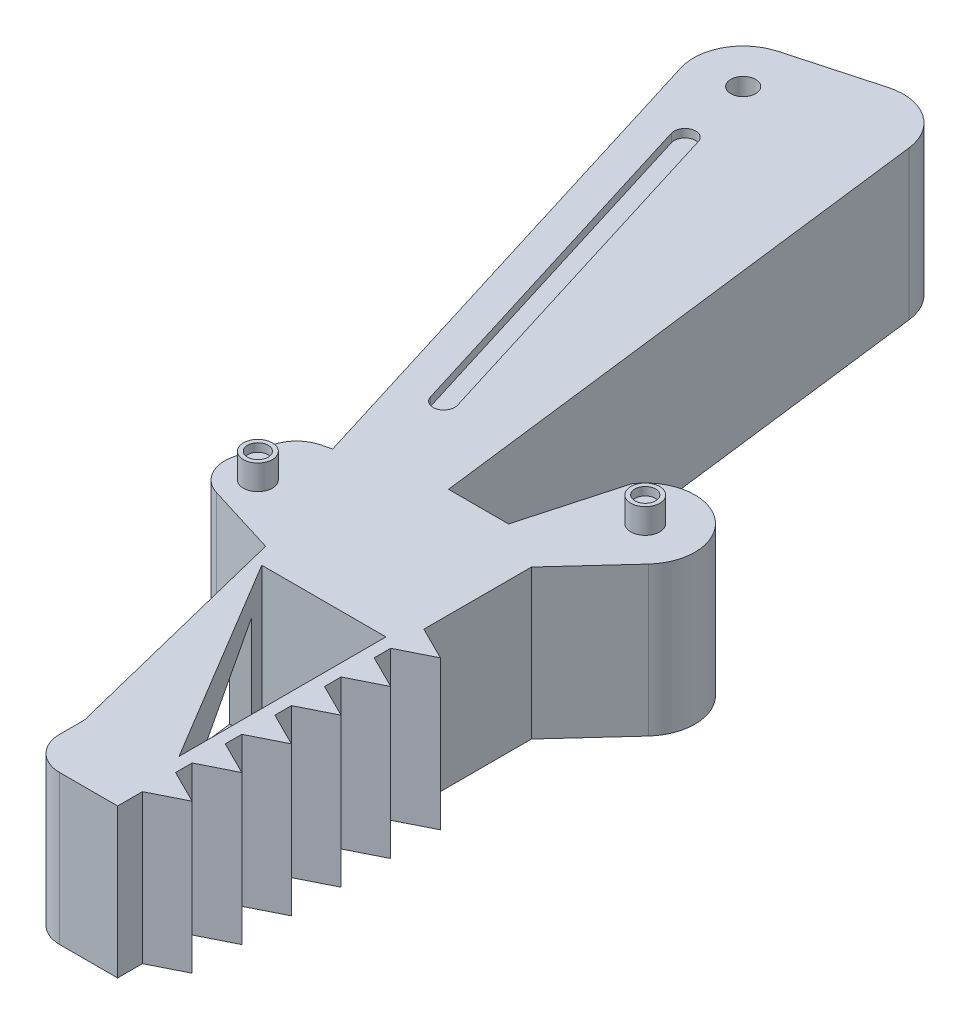
from build123d import *

# Parameters (mm, degrees)
BOSS_EXTRU_1_DEPTH         = 9
CONG_1_R                   = 6
CONG_2_R                   = 4
BOSS_EXTRU_2_DEPTH         = 18
R_P_TITION_LIN_AIRE1_COUNT = 6
R_P_TITION_LIN_AIRE1_PITCH = 6
ENL_V_MAT_EXTRU_1_DEPTH    = 131.397228353
ENL_V_MAT_EXTRU_2_DEPTH    = 10
ESQUISSE5_R                = 1.5
ENL_V_MAT_EXTRU_3_DEPTH    = 131.397228353
ESQUISSE7_R                = 1.75
BOSS_EXTRU_3_DEPTH         = 3
ESQUISSE8_R                = 1.25
ENL_V_MAT_EXTRU_4_DEPTH    = 1
ESQUISSE9_R                = 1.25
ENL_V_MAT_EXTRU_5_DEPTH    = 1
ENL_V_MAT_EXTRU_6_DEPTH    = 1


with BuildPart() as part:
    # Esquisse1 → Boss.-Extru.1 (new, symmetric)
    with BuildSketch(Plane(origin=(0, 0, 0), x_dir=(1, 0, 0), z_dir=(0, 1, 0))):
        with BuildLine():
            ThreePointArc((3.322818072, -58.807369293), (12.01141452, -57.437534528), (12.729634722, -66.204079757))
            Line((12.729634722, -66.204079757), (5.979619104, -73.58224275))
            Line((5.979619104, -73.58224275), (5.979619104, -123.58224275))
            Line((5.979619104, -123.58224275), (-5.020380896, -123.58224275))
            Line((-5.020380896, -123.58224275), (-5.020380896, -116.58224275))
            Line((-5.020380896, -116.58224275), (-12.254374663, -87.467481302))
            Line((-12.254374663, -87.467481302), (-24.674189245, -83.627142028))
            Line((-24.674189245, -83.627142028), (-21.720082111, -74.073438503))
            Line((-21.720082111, -74.073438503), (-7.162701387, -70.45644162))
            Line((-7.162701387, -70.45644162), (0.090794599, -70.45644162))
            Line((0.090794599, -70.45644162), (3.322818072, -58.807369293))
        make_face()
        Polygon((-7.162701387, -70.45644162), (-15.931386255, 0), (-39.070246498, -6.371275122), (-18.378388293, -73.243145172), align=None)
    extrude(amount=BOSS_EXTRU_1_DEPTH, both=True)

    # Congé1
    cong_1_edges = [part.edges().sort_by_distance(p)[0] for p in [
        (-39.070246498, 0, 6.371275122),
        (-15.931386255, 0, 0),
    ]]
    fillet(cong_1_edges, radius=CONG_1_R)

    # Congé2
    cong_2_edges = [part.edges().sort_by_distance(p)[0] for p in [
        (-5.020380896, 0, 123.58224275),
        (-24.674189245, 0, 83.627142028),
        (-21.720082111, 0, 74.073438503),
    ]]
    fillet(cong_2_edges, radius=CONG_2_R)

    # Esquisse2 → Boss.-Extru.2 (add, through all)
    with BuildSketch(Plane(origin=(0, 9, 0), x_dir=(1, 0, 0), z_dir=(0, 1, 0))):
        Polygon((5.979619104, -116.58224275), (5.979619104, -118.58224275), (9.979619104, -118.58224275), align=None)
        Polygon((5.979619104, -118.58224275), (5.979619104, -120.58224275), (9.979619104, -118.58224275), align=None)
    boss_extru_2 = extrude(amount=-BOSS_EXTRU_2_DEPTH)

    # Répétition linéaire1: Boss.-Extru.2 ×6
    with Locations(*[(0, 0, -i * R_P_TITION_LIN_AIRE1_PITCH) for i in range(1, R_P_TITION_LIN_AIRE1_COUNT)]):
        add(boss_extru_2)

    # Esquisse3 → Enlèv. mat.-Extru.1 (cut, through all)
    with BuildSketch(Plane(origin=(0, 9, 0), x_dir=(1, 0, 0), z_dir=(0, 1, 0))):
        Polygon((4.500460605, -114.682587681), (4.500460605, -89.682587681), (-10.499539395, -89.682587681), align=None)
    extrude(amount=-ENL_V_MAT_EXTRU_1_DEPTH, mode=Mode.SUBTRACT)

    # Esquisse4 → Enlèv. mat.-Extru.2 (cut)
    with BuildSketch(Plane(origin=(-32.010787668, 0, 7.953554381), x_dir=(0.24113312555809657, 0, 0.9704920482716916), z_dir=(-0.9704920482716917, 0, 0.2411331255580966))):
        Polygon((87.931559422, 6), (87.931559422, -6), (105.931559422, -3.5), (105.931559422, 3.5), align=None)
    extrude(amount=-ENL_V_MAT_EXTRU_2_DEPTH, mode=Mode.SUBTRACT)

    # Esquisse5 → Enlèv. mat.-Extru.3 (cut, through all)
    with BuildSketch(Plane(origin=(0, 9, 0), x_dir=(1, 0, 0), z_dir=(0, 1, 0))):
        with Locations(Location((-31.508218287, -10.512370957, 0), (0, 0, 270))):
            Circle(ESQUISSE5_R)
    extrude(amount=-ENL_V_MAT_EXTRU_3_DEPTH, mode=Mode.SUBTRACT)

    # Esquisse7 → Boss.-Extru.3 (add)
    with BuildSketch(Plane(origin=(0, 9, 0), x_dir=(1, 0, 0), z_dir=(0, 1, 0))):
        with Locations(Location((-19.671064982, -80.987303471, 0), (0, 0, 270))):
            Circle(ESQUISSE7_R)
        with Locations(Location((8.302736926, -62.154070386, 0), (0, 0, 270))):
            Circle(ESQUISSE7_R)
    boss_extru_3 = extrude(amount=BOSS_EXTRU_3_DEPTH)

    # Esquisse8 → Enlèv. mat.-Extru.4 (cut)
    with BuildSketch(Plane(origin=(0, 12, 0), x_dir=(1, 0, 0), z_dir=(0, 1, 0))):
        with Locations(Location((-19.671064982, -80.987303471, 0), (0, 0, 270))):
            Circle(ESQUISSE8_R)
    enl_v_mat_extru_4 = extrude(amount=-ENL_V_MAT_EXTRU_4_DEPTH, mode=Mode.SUBTRACT)

    # Esquisse9 → Enlèv. mat.-Extru.5 (cut)
    with BuildSketch(Plane(origin=(0, 12, 0), x_dir=(1, 0, 0), z_dir=(0, 1, 0))):
        with Locations(Location((8.302736926, -62.154070386, 0), (0, 0, 270))):
            Circle(ESQUISSE9_R)
    enl_v_mat_extru_5 = extrude(amount=-ENL_V_MAT_EXTRU_5_DEPTH, mode=Mode.SUBTRACT)

    # Esquisse10 → Enlèv. mat.-Extru.6 (cut)
    with BuildSketch(Plane(origin=(0, 9, 0), x_dir=(1, 0, 0), z_dir=(0, 1, 0))):
        with BuildLine():
            Line((-28.470192989, -18.951500143), (-15.418940428, -61.130489417))
            ThreePointArc((-15.418940428, -61.130489417), (-16.281236664, -62.765523067), (-17.916270315, -61.903226831))
            Line((-17.916270315, -61.903226831), (-30.967522877, -19.724237556))
            ThreePointArc((-30.967522877, -19.724237556), (-30.10522664, -18.089203906), (-28.470192989, -18.951500143))
        make_face()
    enl_v_mat_extru_6 = extrude(amount=-ENL_V_MAT_EXTRU_6_DEPTH, mode=Mode.SUBTRACT)

    # Symétrie1: Boss.-Extru.3, Enlèv. mat.-Extru.4, Enlèv. mat.-Extru.5, Enlèv. mat.-Extru.6 across plane
    add(boss_extru_3.mirror(Plane.ZX))
    add(enl_v_mat_extru_4.mirror(Plane.ZX), mode=Mode.SUBTRACT)
    add(enl_v_mat_extru_5.mirror(Plane.ZX), mode=Mode.SUBTRACT)
    add(enl_v_mat_extru_6.mirror(Plane.ZX), mode=Mode.SUBTRACT)


solid = part.part
